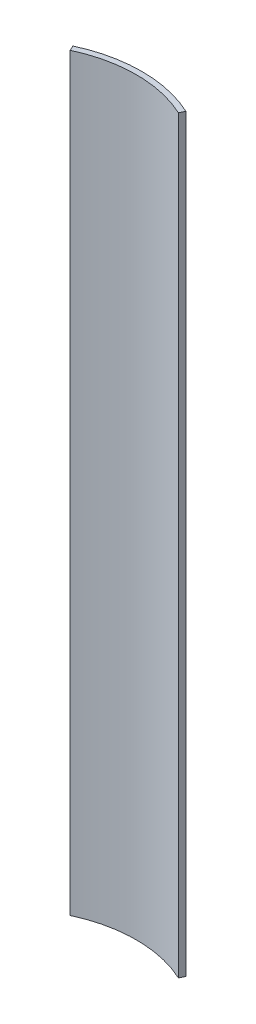
from build123d import *

# Parameters (mm, degrees)
BOSS_EXTRUDE1_DEPTH = 427.1518


with BuildPart() as part:
    # Sketch1 → Boss-Extrude1 (new body)
    with BuildSketch(Plane(origin=(0, 0, 0), x_dir=(1, 0, 0), z_dir=(0, 1, 0))):
        with BuildLine():
            Line((-30.861698564, 66.183126148), (-32.203511545, 69.060653372))
            ThreePointArc((-32.203511545, 69.060653372), (0, 76.2), (32.203511545, 69.060653372))
            Line((32.203511545, 69.060653372), (30.861698564, 66.183126148))
            ThreePointArc((30.861698564, 66.183126148), (0, 73.025), (-30.861698564, 66.183126148))
        make_face()
    extrude(amount=BOSS_EXTRUDE1_DEPTH)


solid = part.part
